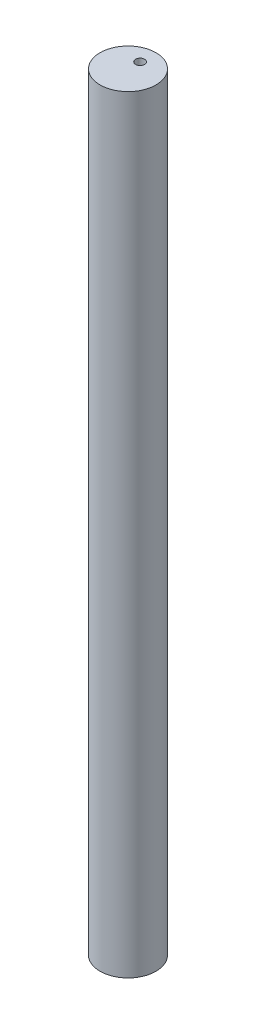
from build123d import *

# Parameters (mm, degrees)
SKETCH2_R           = 11.1
BOSS_EXTRUDE1_DEPTH = 304.8
SKETCH3_R           = 1.8
CUT_EXTRUDE1_DEPTH  = 12.6


with BuildPart() as part:
    # Sketch2 → Boss-Extrude1 (new body)
    with BuildSketch(Plane(origin=(0, 0, 0), x_dir=(1, 0, 0), z_dir=(0, 1, 0))):
        with Locations(Location((0, 0, 0), (0, 0, 90))):
            Circle(SKETCH2_R)
    extrude(amount=BOSS_EXTRUDE1_DEPTH)

    # Sketch3 → Cut-Extrude1 (cut)
    with BuildSketch(Plane(origin=(0, 304.8, 0), x_dir=(1, 0, 0), z_dir=(0, 1, 0))):
        with Locations(Location((0, 4.8, 0), (0, 0, 270))):
            Circle(SKETCH3_R)
    extrude(amount=-CUT_EXTRUDE1_DEPTH, mode=Mode.SUBTRACT)


solid = part.part
